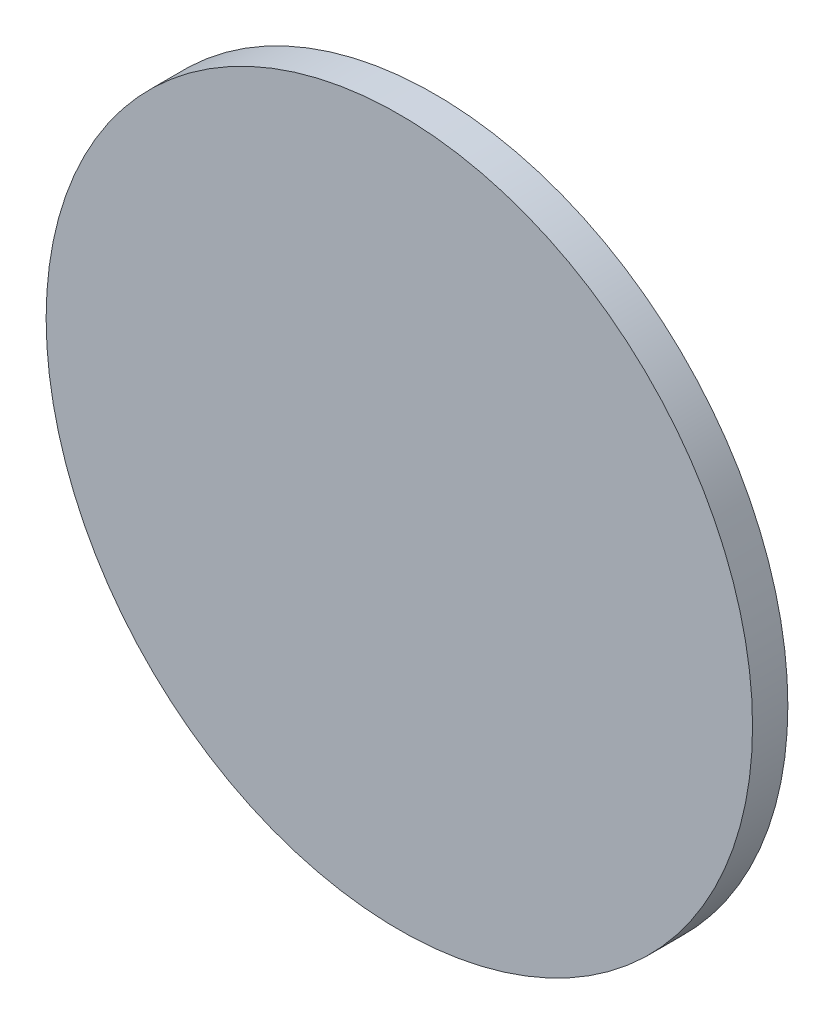
from build123d import *

# Parameters (mm, degrees)
SKETCH1_R           = 2
BOSS_EXTRUDE1_DEPTH = 0.2


with BuildPart() as part:
    # Sketch1 → Boss-Extrude1 (new body)
    with BuildSketch(Plane.XY):
        Circle(SKETCH1_R)
    extrude(amount=BOSS_EXTRUDE1_DEPTH)


solid = part.part
